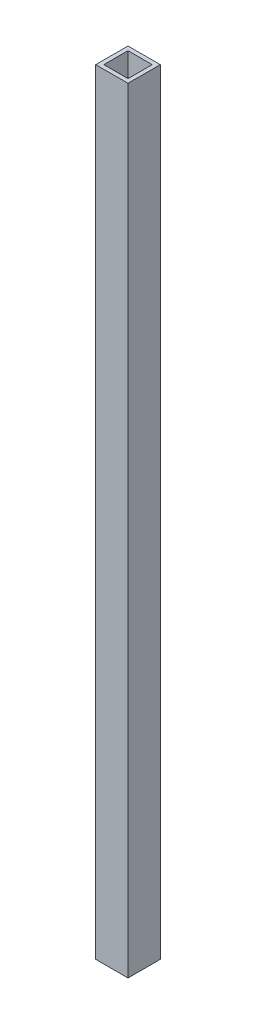
from build123d import *

# Parameters (mm, degrees)
SKETCH1_W           = 25.4
SKETCH1_H           = 25.4
SKETCH1_W_2         = 19.05
SKETCH1_H_2         = 19.05
BOSS_EXTRUDE1_DEPTH = 609.6


with BuildPart() as part:
    # Sketch1 → Boss-Extrude1 (new body)
    with BuildSketch(Plane(origin=(0, 0, 0), x_dir=(1, 0, 0), z_dir=(0, 1, 0))):
        Rectangle(SKETCH1_W, SKETCH1_H)
        Rectangle(SKETCH1_W_2, SKETCH1_H_2, mode=Mode.SUBTRACT)
    extrude(amount=BOSS_EXTRUDE1_DEPTH)


solid = part.part
